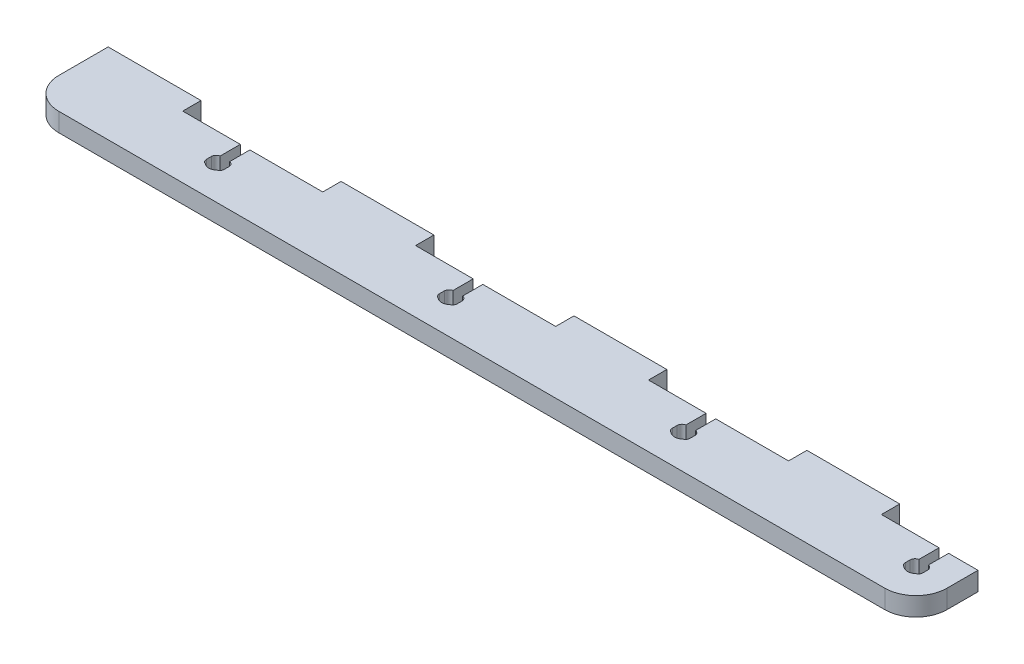
from build123d import *

# Parameters (mm, degrees)
SALIENTE_EXTRUIR1_DEPTH = 6


with BuildPart() as part:
    # Croquis1 → Saliente-Extruir1 (new body)
    with BuildSketch(Plane(origin=(0, 0, 0), x_dir=(1, 0, 0), z_dir=(0, 1, 0))):
        with BuildLine():
            ThreePointArc((-95.152264236, 14.320303243), (-94.78653124, 15.320309075), (-93.861926606, 15.848398611))
            Line((-93.861926606, 15.848398611), (-93.861926606, 22.348623853))
            Line((-93.861926606, 22.348623853), (-112.411926606, 22.348623853))
            Line((-112.411926606, 22.348623853), (-112.411926606, 28.248623853))
            Line((-112.411926606, 28.248623853), (-142.311926606, 28.248623853))
            Line((-142.311926606, 28.248623853), (-142.311926606, 22.348623853))
            Line((-142.311926606, 22.348623853), (-142.311926606, 12.348623853))
            ThreePointArc((-142.311926606, 12.348623853), (-139.382994417, 5.277556041), (-132.311926606, 2.348623853))
            Line((-132.311926606, 2.348623853), (127.688073394, 2.348623853))
            Line((127.688073394, 2.348623853), (133.688073394, 2.348623853))
            ThreePointArc((133.688073394, 2.348623853), (140.759141206, 5.277556041), (143.688073394, 12.348623853))
            Line((143.688073394, 12.348623853), (143.688073394, 22.348623853))
            Line((143.688073394, 22.348623853), (137.688073394, 22.348623853))
            Line((137.688073394, 22.348623853), (134.238073394, 22.348623853))
            Line((134.238073394, 22.348623853), (134.238073394, 15.848398611))
            ThreePointArc((134.238073394, 15.848398611), (135.162678029, 15.320309075), (135.528411025, 14.320303243))
            Line((135.528411025, 14.320303243), (135.528411025, 12.770303243))
            ThreePointArc((135.528411025, 12.770303243), (135.339714195, 12.029119271), (134.819567568, 11.468398611))
            Line((134.819567568, 11.468398611), (134.650322636, 11.468398611))
            ThreePointArc((134.650322636, 11.468398611), (132.688073394, 10.655388626), (130.725824153, 11.468398611))
            Line((130.725824153, 11.468398611), (130.556579221, 11.468398611))
            ThreePointArc((130.556579221, 11.468398611), (130.036432594, 12.029119271), (129.847735764, 12.770303243))
            Line((129.847735764, 12.770303243), (129.847735764, 14.320303243))
            ThreePointArc((129.847735764, 14.320303243), (130.21346876, 15.320309075), (131.138073394, 15.848398611))
            Line((131.138073394, 15.848398611), (131.138073394, 22.348623853))
            Line((131.138073394, 22.348623853), (112.588073394, 22.348623853))
            Line((112.588073394, 22.348623853), (112.588073394, 28.248623853))
            Line((112.588073394, 28.248623853), (82.688073394, 28.248623853))
            Line((82.688073394, 28.248623853), (82.688073394, 22.348623853))
            Line((82.688073394, 22.348623853), (59.238073394, 22.348623853))
            Line((59.238073394, 22.348623853), (59.238073394, 15.848398611))
            ThreePointArc((59.238073394, 15.848398611), (60.162678029, 15.320309075), (60.528411025, 14.320303243))
            Line((60.528411025, 14.320303243), (60.528411025, 12.770303243))
            ThreePointArc((60.528411025, 12.770303243), (60.339714195, 12.029119271), (59.819567568, 11.468398611))
            Line((59.819567568, 11.468398611), (59.650322636, 11.468398611))
            ThreePointArc((59.650322636, 11.468398611), (57.688073394, 10.655388626), (55.725824153, 11.468398611))
            Line((55.725824153, 11.468398611), (55.556579221, 11.468398611))
            ThreePointArc((55.556579221, 11.468398611), (55.036432594, 12.029119271), (54.847735764, 12.770303243))
            Line((54.847735764, 12.770303243), (54.847735764, 14.320303243))
            ThreePointArc((54.847735764, 14.320303243), (55.21346876, 15.320309075), (56.138073394, 15.848398611))
            Line((56.138073394, 15.848398611), (56.138073394, 22.348623853))
            Line((56.138073394, 22.348623853), (37.588073394, 22.348623853))
            Line((37.588073394, 22.348623853), (37.588073394, 28.248623853))
            Line((37.588073394, 28.248623853), (7.688073394, 28.248623853))
            Line((7.688073394, 28.248623853), (7.688073394, 22.348623853))
            Line((7.688073394, 22.348623853), (-15.761926606, 22.348623853))
            Line((-15.761926606, 22.348623853), (-15.761926606, 15.848398611))
            ThreePointArc((-15.761926606, 15.848398611), (-14.837321971, 15.320309075), (-14.471588975, 14.320303243))
            Line((-14.471588975, 14.320303243), (-14.471588975, 12.770303243))
            ThreePointArc((-14.471588975, 12.770303243), (-14.660285805, 12.029119271), (-15.180432432, 11.468398611))
            Line((-15.180432432, 11.468398611), (-15.349677364, 11.468398611))
            ThreePointArc((-15.349677364, 11.468398611), (-17.311926606, 10.655388626), (-19.274175847, 11.468398611))
            Line((-19.274175847, 11.468398611), (-19.443420779, 11.468398611))
            ThreePointArc((-19.443420779, 11.468398611), (-19.963567406, 12.029119271), (-20.152264236, 12.770303243))
            Line((-20.152264236, 12.770303243), (-20.152264236, 14.320303243))
            ThreePointArc((-20.152264236, 14.320303243), (-19.78653124, 15.320309075), (-18.861926606, 15.848398611))
            Line((-18.861926606, 15.848398611), (-18.861926606, 22.348623853))
            Line((-18.861926606, 22.348623853), (-37.411926606, 22.348623853))
            Line((-37.411926606, 22.348623853), (-37.411926606, 28.248623853))
            Line((-37.411926606, 28.248623853), (-67.311926606, 28.248623853))
            Line((-67.311926606, 28.248623853), (-67.311926606, 22.348623853))
            Line((-67.311926606, 22.348623853), (-90.761926606, 22.348623853))
            Line((-90.761926606, 22.348623853), (-90.761926606, 15.848398611))
            ThreePointArc((-90.761926606, 15.848398611), (-89.837321971, 15.320309075), (-89.471588975, 14.320303243))
            Line((-89.471588975, 14.320303243), (-89.471588975, 12.770303243))
            ThreePointArc((-89.471588975, 12.770303243), (-89.660285805, 12.029119271), (-90.180432432, 11.468398611))
            Line((-90.180432432, 11.468398611), (-90.349677364, 11.468398611))
            ThreePointArc((-90.349677364, 11.468398611), (-92.311926606, 10.655388626), (-94.274175847, 11.468398611))
            Line((-94.274175847, 11.468398611), (-94.443420779, 11.468398611))
            ThreePointArc((-94.443420779, 11.468398611), (-94.963567406, 12.029119271), (-95.152264236, 12.770303243))
            Line((-95.152264236, 12.770303243), (-95.152264236, 14.320303243))
        make_face()
    extrude(amount=SALIENTE_EXTRUIR1_DEPTH)


solid = part.part
